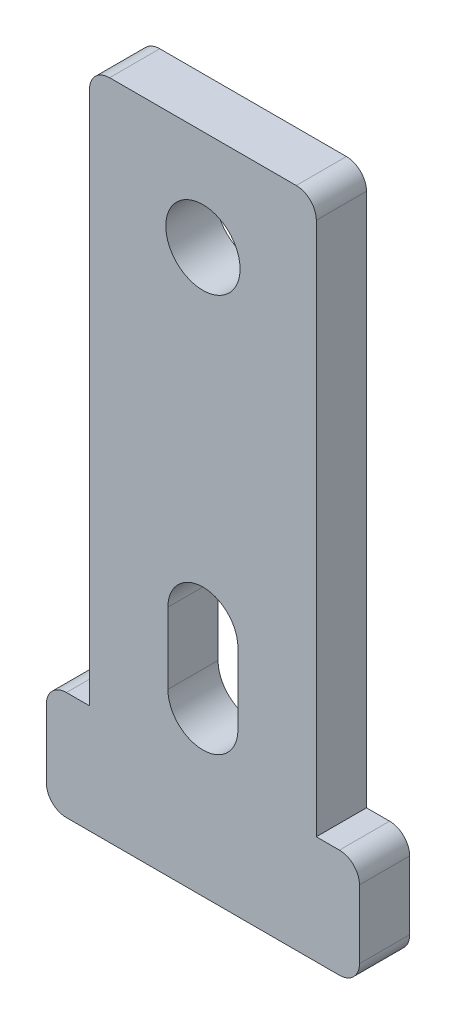
from build123d import *

# Parameters (mm, degrees)
CROQUIS1_R              = 1.85
SALIENTE_EXTRUIR1_DEPTH = 2.5
REDONDEO1_R             = 1


with BuildPart() as part:
    # Croquis1 → Saliente-Extruir1 (new body)
    with BuildSketch(Plane.XY):
        Polygon((-7.8, -16.5), (-5.65, -16.5), (0, -16.5), (5.65, -16.5), (7.8, -16.5), (7.8, -11.1), (5.65, -11.1), (5.65, 16.5), (-5.65, 16.5), (-5.65, -11.1), (-7.8, -11.1), align=None)
        with BuildLine():
            ThreePointArc((1.744493193, -8.435965803), (0, -10.180458996), (-1.744493193, -8.435965803))
            Line((-1.744493193, -8.435965803), (-1.744493193, -4.893383092))
            ThreePointArc((-1.744493193, -4.893383092), (0, -3.148889899), (1.744493193, -4.893383092))
            Line((1.744493193, -4.893383092), (1.744493193, -8.435965803))
        make_face(mode=Mode.SUBTRACT)
        with Locations((0, 11.5)):
            Circle(CROQUIS1_R, mode=Mode.SUBTRACT)
    extrude(amount=SALIENTE_EXTRUIR1_DEPTH)

    # Redondeo1
    redondeo1_edges = [part.edges().sort_by_distance(p)[0] for p in [
        (7.8, -11.1, 1.25),
        (7.8, -16.5, 1.25),
        (-7.8, -16.5, 1.25),
        (-7.8, -11.1, 1.25),
        (-5.65, 16.5, 1.25),
        (5.65, 16.5, 1.25),
    ]]
    fillet(redondeo1_edges, radius=REDONDEO1_R)


solid = part.part
